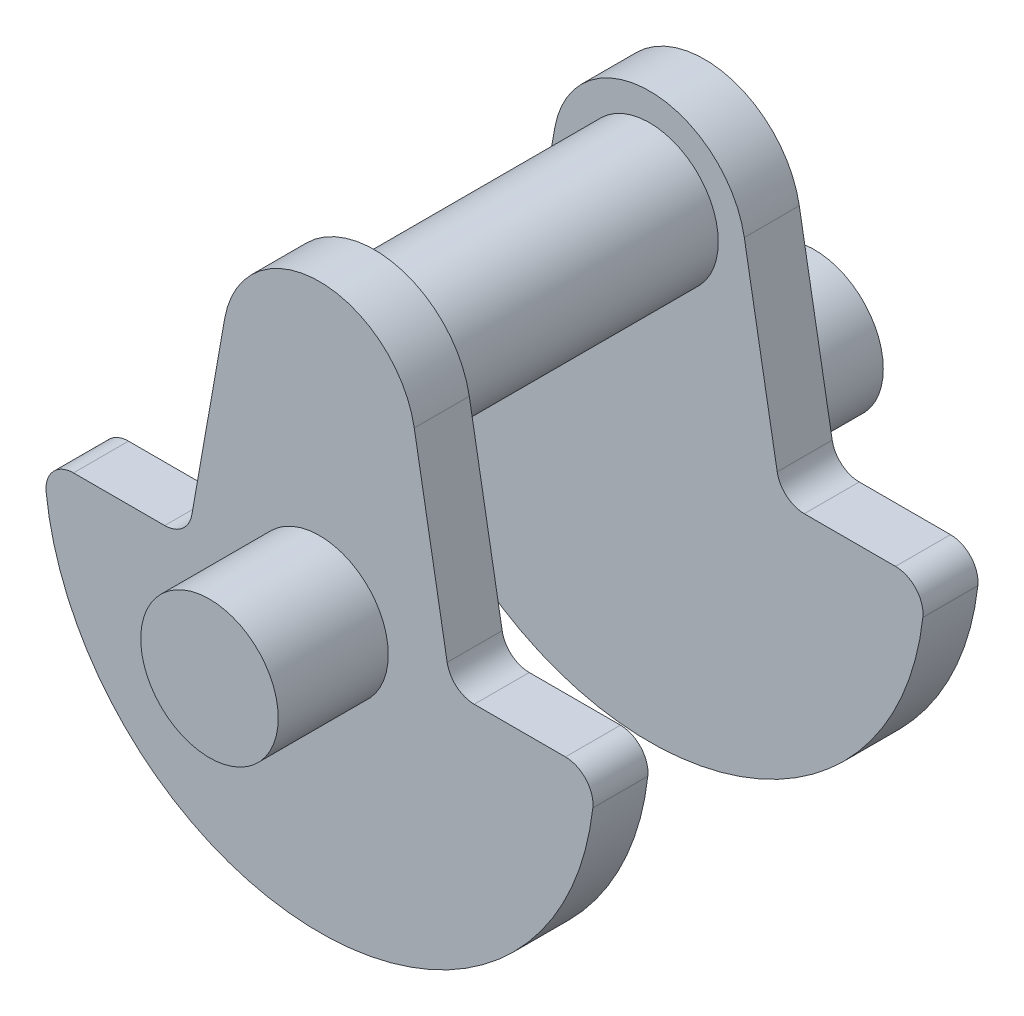
from build123d import *

# Parameters (mm, degrees)
BOSS_EXTRUDE1_DEPTH = 10
SKETCH2_R           = 12.5
BOSS_EXTRUDE2_DEPTH = 20
SKETCH3_R           = 12.5
BOSS_EXTRUDE4_DEPTH = 25


with BuildPart() as part:
    # Sketch1 → Boss-Extrude1 (new body)
    with BuildSketch(Plane.XY):
        with BuildLine():
            Line((-44.72135955, -35), (-28.136908189, -35))
            ThreePointArc((-28.136908189, -35), (-24.92297014, -33.830222216), (-23.212869424, -30.868240888))
            Line((-23.212869424, -30.868240888), (-17.234135678, 3.038843109))
            ThreePointArc((-17.234135678, 3.038843109), (0, 17.5), (17.234135678, 3.038843109))
            Line((17.234135678, 3.038843109), (23.212869424, -30.868240888))
            ThreePointArc((23.212869424, -30.868240888), (24.92297014, -33.830222216), (28.136908189, -35))
            Line((28.136908189, -35), (44.72135955, -35))
            ThreePointArc((44.72135955, -35), (48.448139512, -36.666666667), (49.6903995, -40.555555556))
            ThreePointArc((49.6903995, -40.555555556), (0, -85), (-49.6903995, -40.555555556))
            ThreePointArc((-49.6903995, -40.555555556), (-48.448139512, -36.666666667), (-44.72135955, -35))
        make_face()
    extrude(amount=BOSS_EXTRUDE1_DEPTH)

    # Sketch2 → Boss-Extrude2 (add)
    with BuildSketch(Plane.XY.offset(10)):
        with Locations((0, -35)):
            Circle(SKETCH2_R)
    extrude(amount=BOSS_EXTRUDE2_DEPTH)

    # Sketch3 → Boss-Extrude4 (add)
    with BuildSketch(Plane(origin=(0, 0, 0), x_dir=(-1, 0, 0), z_dir=(0, 0, -1))):
        with Locations(Location((0, 0, 0), (0, 0, 180))):
            Circle(SKETCH3_R)
    extrude(amount=BOSS_EXTRUDE4_DEPTH)

    # Mirror2: part across plane


with BuildPart() as part_1:
    add(part.part)
    add(part.part.mirror(Plane(origin=(0, 0, -25), x_dir=(1, 0, 0), z_dir=(0, 0, -1))))


solid = part_1.part
